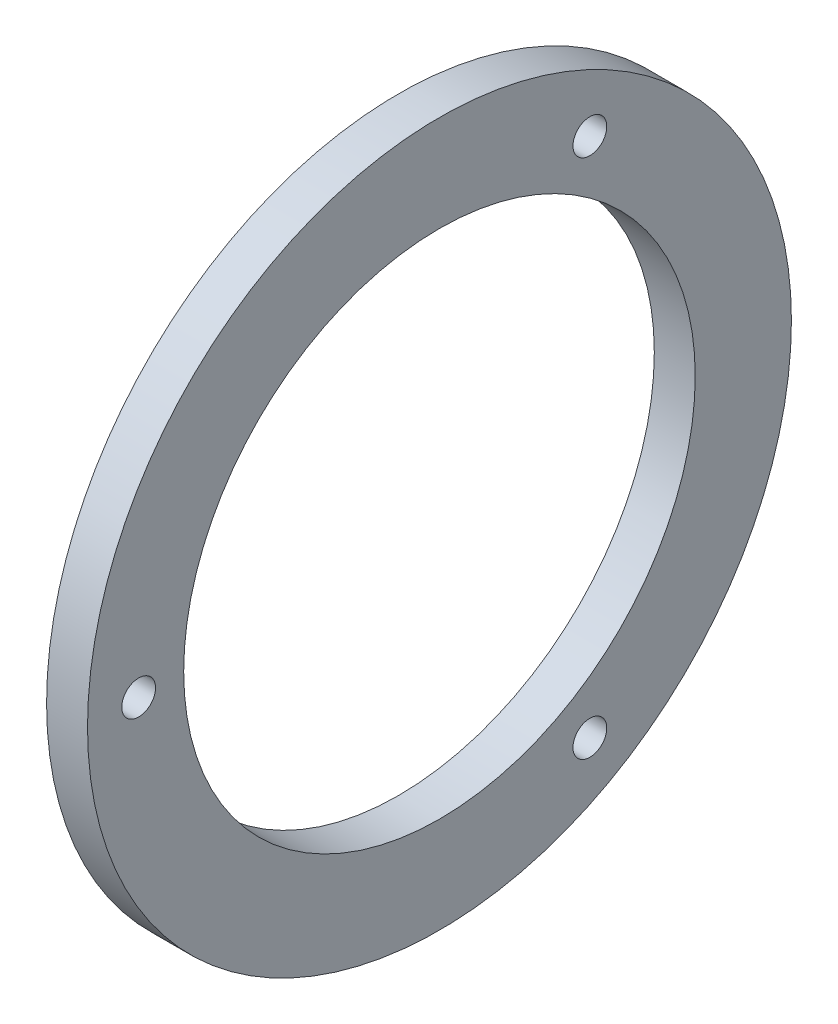
from build123d import *

# Parameters (mm, degrees)
AXIAL_PROFILE_MM_W     = 4
AXIAL_PROFILE_MM_H     = 9.4
AXIAL_HOLES_DEPTH      = 171.775905795
AXIAL_HOLES_DEPTH_BACK = 171.775905795
SKETCH2_R              = 1.65


with BuildPart() as part:
    # Axial profile (mm) → Full revolution (revolve)
    with BuildSketch(Plane.XY, mode=Mode.PRIVATE) as full_revolution_sk:
        with Locations((161.7, 29.7)):
            Rectangle(AXIAL_PROFILE_MM_W, AXIAL_PROFILE_MM_H)
    revolve(full_revolution_sk.sketch.rotate(Axis((-110, 0, 0), (1, 0, 0)), 90), axis=Axis((-110, 0, 0), (1, 0, 0)))

    # Sketch2 → Axial holes (cut, two sides: drawn at the far end of the back side and taken through both)
    with BuildSketch(Plane(origin=(0, 0, 0), x_dir=(0, 0, -1), z_dir=(1, 0, 0)).offset(-AXIAL_HOLES_DEPTH_BACK)):
        with Locations((-29.4, 0)):
            Circle(SKETCH2_R)
        with Locations((14.7, -25.461146871)):
            Circle(SKETCH2_R)
        with Locations((14.7, 25.461146871)):
            Circle(SKETCH2_R)
    extrude(amount=AXIAL_HOLES_DEPTH + AXIAL_HOLES_DEPTH_BACK, mode=Mode.SUBTRACT)


solid = part.part
